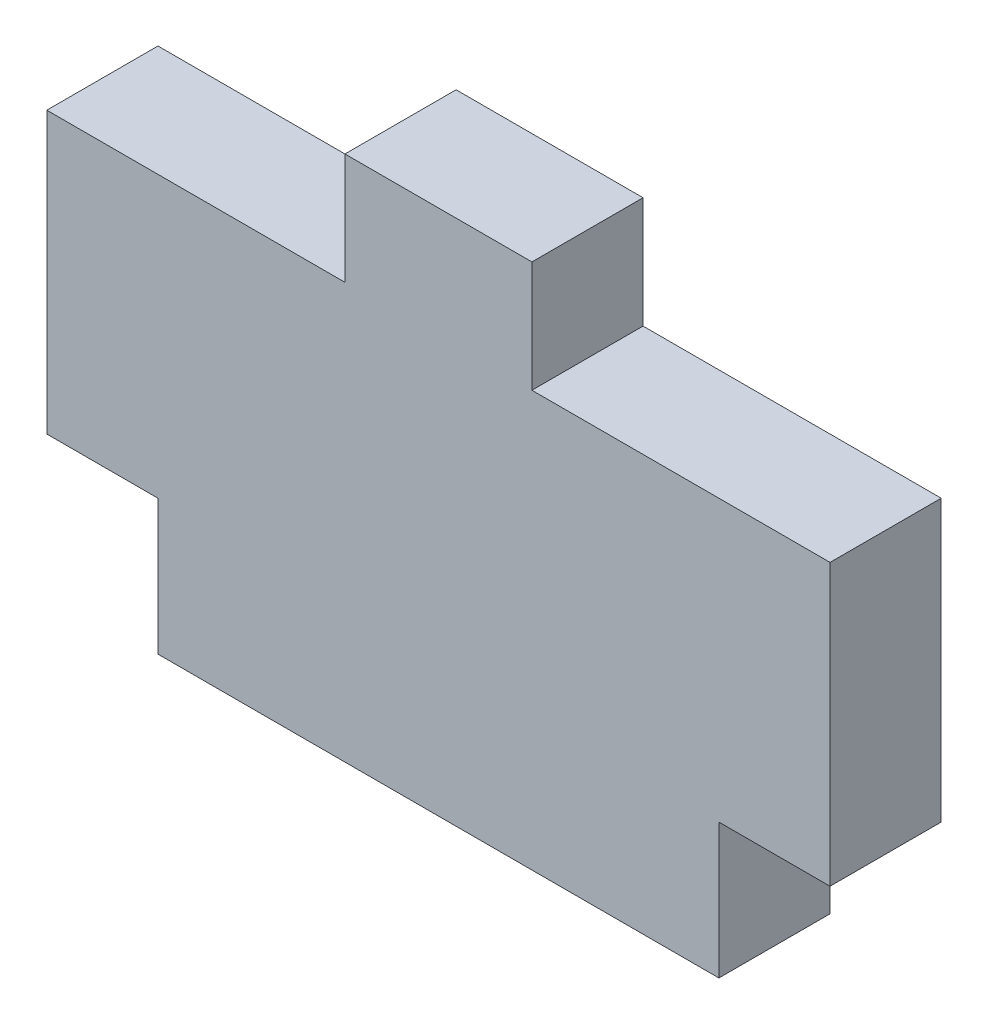
from build123d import *

# Parameters (mm, degrees)
BOSS_EXTRUDE1_DEPTH = 5.35


with BuildPart() as part:
    # Model → Boss-Extrude1 (new body)
    with BuildSketch(Plane.XY):
        Polygon((4.5, 20), (18.85, 20), (18.85, 6.5), (13.5, 6.5), (13.5, 0), (-13.5, 0), (-13.5, 6.5), (-18.85, 6.5), (-18.85, 20), (-4.5, 20), (-4.5, 25.35), (4.5, 25.35), align=None)
    extrude(amount=BOSS_EXTRUDE1_DEPTH)


solid = part.part
